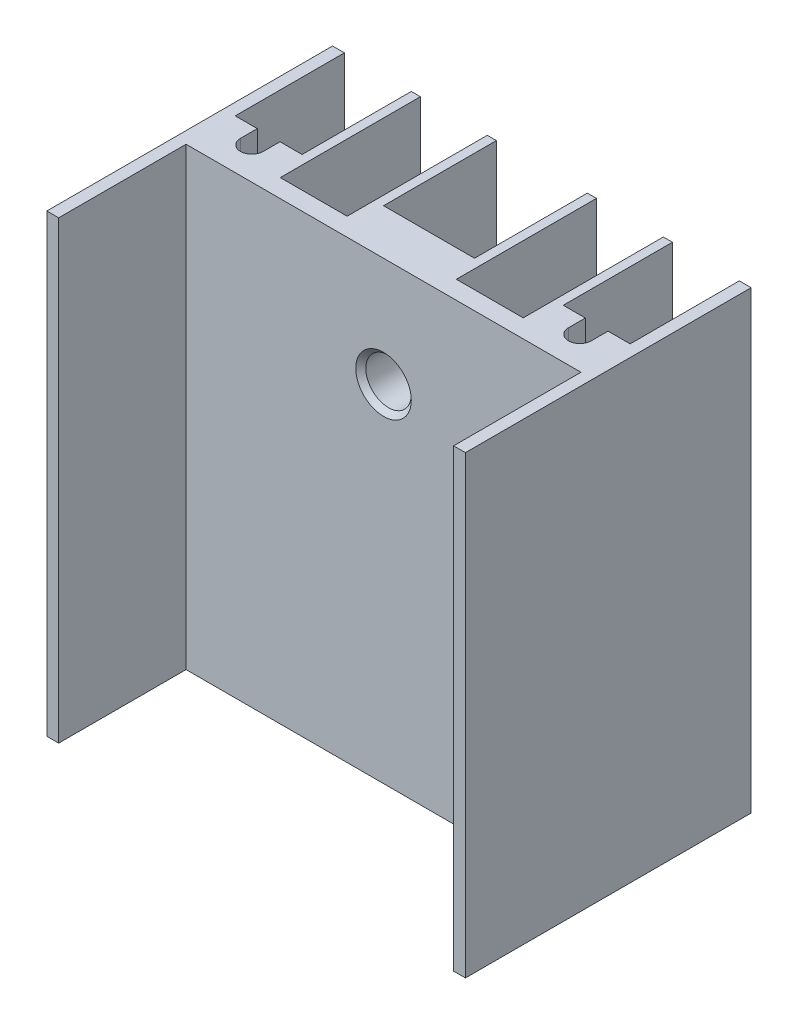
from build123d import *

# Parameters (mm, degrees)
BOSS_EXTRUDE1_DEPTH         = 25
M3_TAPPED_HOLE1_D           = 2.5
M3_TAPPED_HOLE1_CSINK_D     = 3.05
M3_TAPPED_HOLE1_CSINK_ANGLE = 90


with BuildPart() as part:
    # Sketch1 → Boss-Extrude1 (new body)
    with BuildSketch(Plane(origin=(0, 0, 0), x_dir=(1, 0, 0), z_dir=(0, 1, 0))):
        with BuildLine():
            Line((-11.5, 8.7), (-10.85, 8.7))
            Line((-10.85, 8.7), (-10.85, 2.7))
            Line((-10.85, 2.7), (-9.6375, 2.7))
            Line((-9.6375, 2.7), (-9.6375, 1.775))
            ThreePointArc((-9.6375, 1.775), (-9.0125, 1.15), (-8.3875, 1.775))
            Line((-8.3875, 1.775), (-8.3875, 2.7))
            Line((-8.3875, 2.7), (-7.175, 2.7))
            Line((-7.175, 2.7), (-7.175, 8.7))
            Line((-7.175, 8.7), (-6.675, 8.7))
            Line((-6.675, 8.7), (-6.675, 1))
            Line((-6.675, 1), (-3, 1))
            Line((-3, 1), (-3, 8.7))
            Line((-3, 8.7), (-2.5, 8.7))
            Line((-2.5, 8.7), (-2.5, 2.5))
            Line((-2.5, 2.5), (2.5, 2.5))
            Line((2.5, 2.5), (2.5, 8.7))
            Line((2.5, 8.7), (3, 8.7))
            Line((3, 8.7), (3, 1))
            Line((3, 1), (6.675, 1))
            Line((6.675, 1), (6.675, 8.7))
            Line((6.675, 8.7), (7.175, 8.7))
            Line((7.175, 8.7), (7.175, 2.7))
            Line((7.175, 2.7), (8.3875, 2.7))
            Line((8.3875, 2.7), (8.3875, 1.775))
            ThreePointArc((8.3875, 1.775), (9.0125, 1.15), (9.6375, 1.775))
            Line((9.6375, 1.775), (9.6375, 2.7))
            Line((9.6375, 2.7), (10.85, 2.7))
            Line((10.85, 2.7), (10.85, 8.7))
            Line((10.85, 8.7), (11.5, 8.7))
            Line((11.5, 8.7), (11.5, -7))
            Line((11.5, -7), (10.85, -7))
            Line((10.85, -7), (10.85, 0))
            Line((10.85, 0), (-10.85, 0))
            Line((-10.85, 0), (-10.85, -7))
            Line((-10.85, -7), (-11.5, -7))
            Line((-11.5, -7), (-11.5, 8.7))
        make_face()
    extrude(amount=BOSS_EXTRUDE1_DEPTH)

    # M3 Tapped Hole1 (through all)
    with Locations(Plane.XY):
        with Locations((0, 19)):
            CounterSinkHole(M3_TAPPED_HOLE1_D / 2, M3_TAPPED_HOLE1_CSINK_D / 2, counter_sink_angle=M3_TAPPED_HOLE1_CSINK_ANGLE)


solid = part.part
